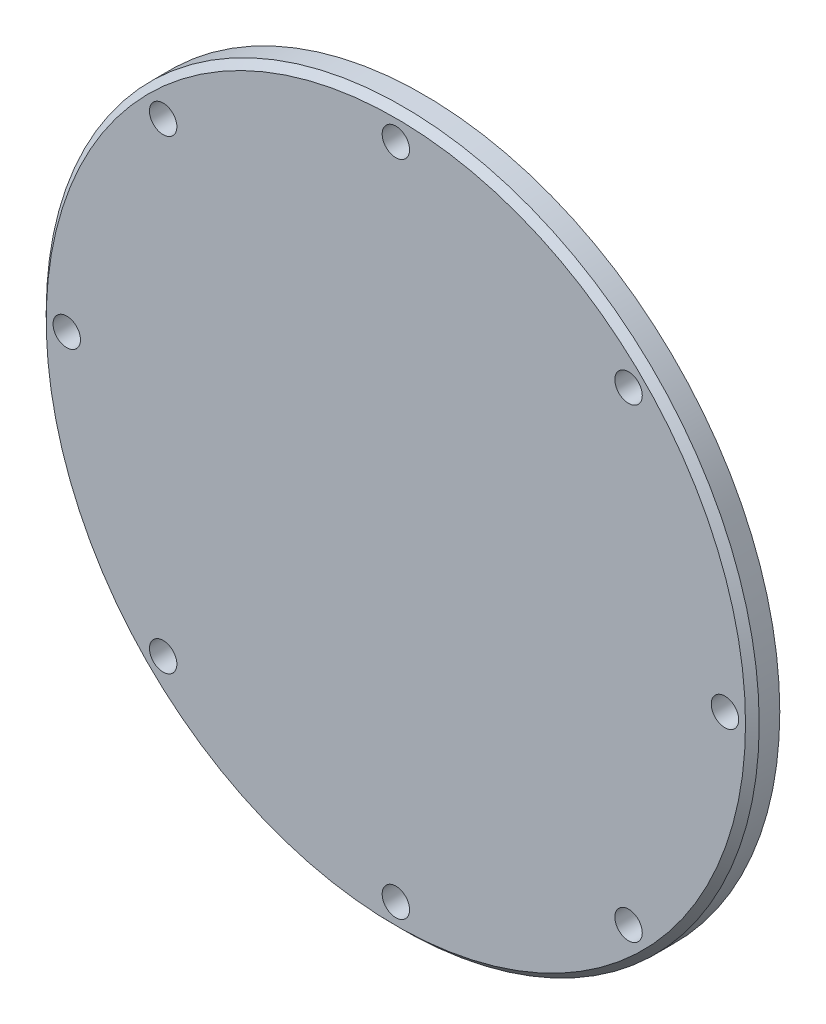
from build123d import *

# Parameters (mm, degrees)
SKETCH_1_R          = 26
EXTRUDE_1_DEPTH     = 2
SKETCH_2_R          = 1
CUT_EXTRUDE_1_DEPTH = 2
CHAMFER_2_SIZE      = 0.5


with BuildPart() as part:
    # Эскиз1 → Бобышка-Вытянуть1 (new body)
    with BuildSketch(Plane.XY):
        Circle(SKETCH_1_R)
    extrude(amount=EXTRUDE_1_DEPTH)

    # Эскиз2 → Вырез-Вытянуть1 (cut)
    with BuildSketch(Plane.XY.offset(2)):
        with Locations((0, 24)):
            Circle(SKETCH_2_R)
        with Locations((16.970562748, 16.970562748)):
            Circle(SKETCH_2_R)
        with Locations((24, 0)):
            Circle(SKETCH_2_R)
        with Locations((16.970562748, -16.970562748)):
            Circle(SKETCH_2_R)
        with Locations((0, -24)):
            Circle(SKETCH_2_R)
        with Locations((-16.970562748, -16.970562748)):
            Circle(SKETCH_2_R)
        with Locations((-24, 0)):
            Circle(SKETCH_2_R)
        with Locations((-16.970562748, 16.970562748)):
            Circle(SKETCH_2_R)
    extrude(amount=-CUT_EXTRUDE_1_DEPTH, mode=Mode.SUBTRACT)

    # Фаска2
    chamfer_2_edges = [part.edges().sort_by_distance(p)[0] for p in [
        (-26, 0, 2),
    ]]
    chamfer(chamfer_2_edges, length=CHAMFER_2_SIZE)


solid = part.part
